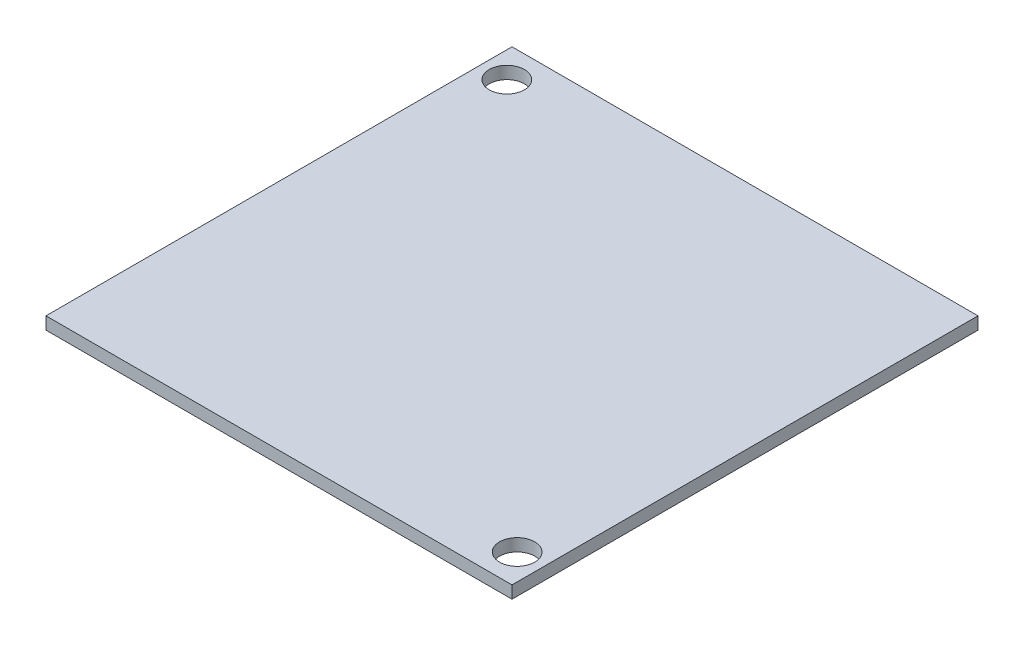
from build123d import *

# Parameters (mm, degrees)
SKETCH1_W            = 45
SKETCH1_H            = 45
BOSS_EXTRUDE1_DEPTH  = 1.2
M3_CLEARANCE_HOLE1_D = 3.4


with BuildPart() as part:
    # Sketch1 → Boss-Extrude1 (new body)
    with BuildSketch(Plane(origin=(0, 0, 0), x_dir=(1, 0, 0), z_dir=(0, 1, 0))):
        with Locations((-2.277491725, -21.141351661)):
            Rectangle(SKETCH1_W, SKETCH1_H)
    extrude(amount=BOSS_EXTRUDE1_DEPTH)

    # M3 Clearance Hole1 (through all)
    with Locations(Plane(origin=(-22.277491725, 1.2, 1.641351661), x_dir=(0, 0, 1), z_dir=(0, 1, 0))):
        with Locations((0, 0), (39, 40)):
            Hole(M3_CLEARANCE_HOLE1_D / 2)


solid = part.part
